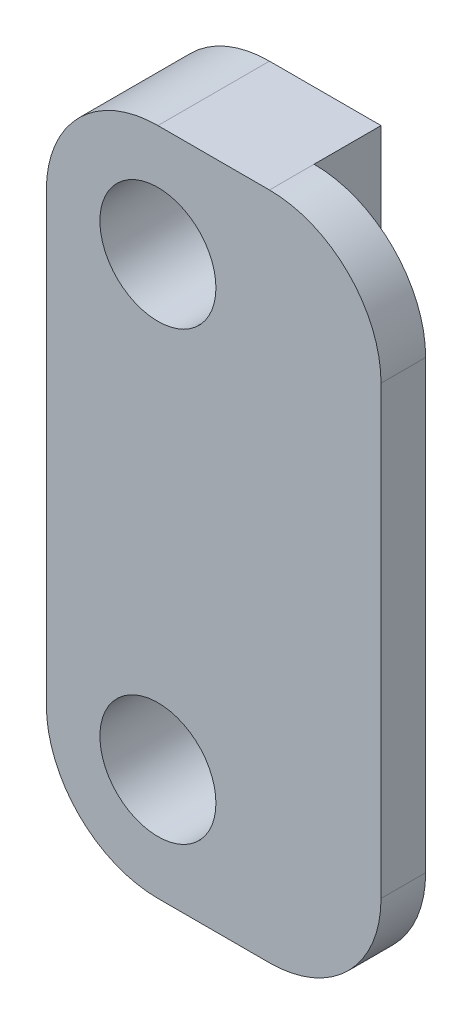
from build123d import *

# Parameters (mm, degrees)
ESQUISSE1_W        = 10
ESQUISSE1_H        = 30
ESQUISSE1_R        = 2.6
BOSS_EXTRU_1_DEPTH = 5
ESQUISSE2_W        = 2
ESQUISSE2_H        = 30
BOSS_EXTRU_2_DEPTH = 5
CONG_1_R           = 5


with BuildPart() as part:
    # Esquisse1 → Boss.-Extru.1 (new body)
    with BuildSketch(Plane.XY):
        with Locations((40, -67.25)):
            Rectangle(ESQUISSE1_W, ESQUISSE1_H)
        with Locations((40, -77.25)):
            Circle(ESQUISSE1_R, mode=Mode.SUBTRACT)
        with Locations((40, -57.25)):
            Circle(ESQUISSE1_R, mode=Mode.SUBTRACT)
    extrude(amount=BOSS_EXTRU_1_DEPTH)

    # Esquisse2 → Boss.-Extru.2 (add)
    with BuildSketch(Plane(origin=(45, 0, 0), x_dir=(0, 0, -1), z_dir=(1, 0, 0))):
        with Locations((-4, -67.25)):
            Rectangle(ESQUISSE2_W, ESQUISSE2_H)
    extrude(amount=BOSS_EXTRU_2_DEPTH)

    # Congé1
    cong_1_edges = [part.edges().sort_by_distance(p)[0] for p in [
        (50, -82.25, 4),
        (50, -52.25, 4),
        (35, -52.25, 2.5),
        (35, -82.25, 2.5),
    ]]
    fillet(cong_1_edges, radius=CONG_1_R)


solid = part.part
